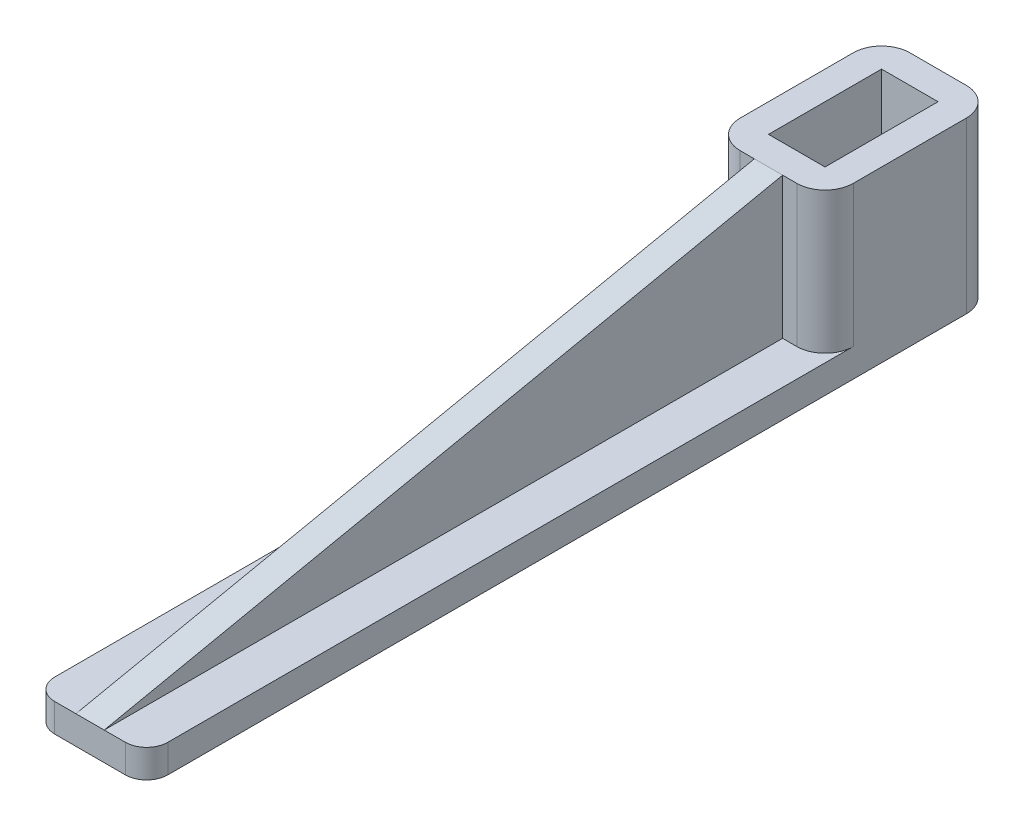
from build123d import *

# Parameters (mm, degrees)
SKETCH_1_W      = 20
SKETCH_1_H      = 30
SKETCH_1_W_2    = 10
SKETCH_1_H_2    = 20
EXTRUDE_1_DEPTH = 30
SKETCH_1_3_W    = 20
SKETCH_1_3_H    = 120
EXTRUDE_2_DEPTH = 5
RIB_1_REACH     = 140.654
SKETCH_2_WALL_W = 401.884999198
SKETCH_2_WALL_H = 5
FILLET_1_R      = 5
FILLET_3_R      = 3.75


with BuildPart() as part:
    # Эскиз1 → Бобышка-Вытянуть1 (new body)
    with BuildSketch(Plane(origin=(0, 0, 0), x_dir=(1, 0, 0), z_dir=(0, 1, 0))):
        Rectangle(SKETCH_1_W, SKETCH_1_H)
        Rectangle(SKETCH_1_W_2, SKETCH_1_H_2, mode=Mode.SUBTRACT)
    extrude(amount=EXTRUDE_1_DEPTH)

    # Эскиз1<3> → Бобышка-Вытянуть2 (add)
    with BuildSketch(Plane(origin=(0, 0, 0), x_dir=(1, 0, 0), z_dir=(0, 1, 0))):
        with Locations((0, -75)):
            Rectangle(SKETCH_1_3_W, SKETCH_1_3_H)
    extrude(amount=EXTRUDE_2_DEPTH)

    # Эскиз2 wall → Ребро1 (add, up to next)
    with BuildSketch(Plane(origin=(0, 17.5, 75), x_dir=(0, 0.203954254112, -0.978980419738), z_dir=(0, 0.978980419738, 0.203954254112)), mode=Mode.PRIVATE) as rib_1_sk1:
        Rectangle(SKETCH_2_WALL_W, SKETCH_2_WALL_H)
    rib_1_tool1 = extrude(rib_1_sk1.sketch, amount=-RIB_1_REACH, mode=Mode.PRIVATE) - part.part
    add(rib_1_tool1.solids().sort_by_distance((0, 17.5, 75))[0])

    # Скругление1
    fillet_1_edges = [part.edges().sort_by_distance(p)[0] for p in [
        (-10, 17.5, 15),
        (-10, 15, -15),
        (10, 15, -15),
        (10, 17.5, 15),
    ]]
    fillet(fillet_1_edges, radius=FILLET_1_R)

    # Скругление3
    fillet_3_edges = [part.edges().sort_by_distance(p)[0] for p in [
        (-10, 2.5, 135),
        (10, 2.5, 135),
    ]]
    fillet(fillet_3_edges, radius=FILLET_3_R)


solid = part.part
